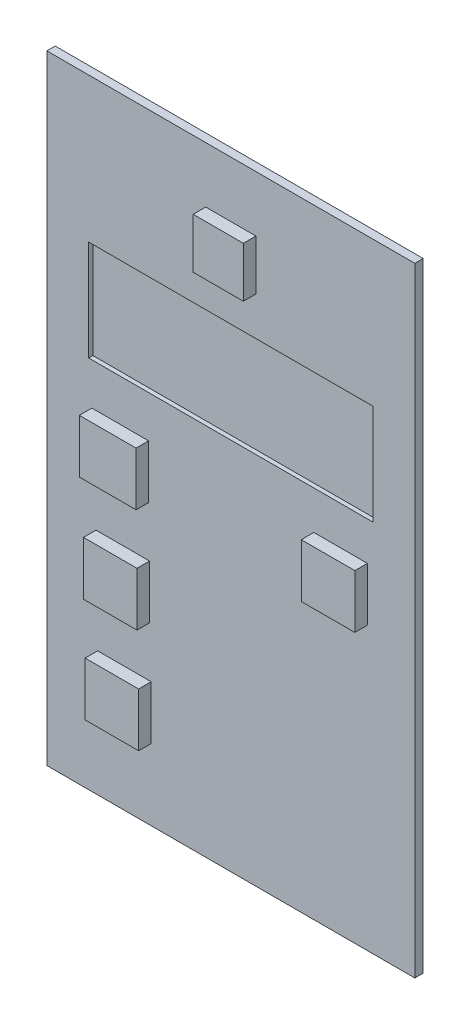
from build123d import *

# Parameters (mm, degrees)
SKETCH1_W           = 44
SKETCH1_H           = 74
BOSS_EXTRUDE1_DEPTH = 1
SKETCH2_W           = 34
SKETCH2_H           = 12
CUT_EXTRUDE1_DEPTH  = 0.5
SKETCH3_W           = 6
SKETCH3_H           = 6
BOSS_EXTRUDE2_DEPTH = 1.5
SKETCH5_W           = 6.780779409
SKETCH5_H           = 6.387690747
BOSS_EXTRUDE5_DEPTH = 1.5
SKETCH7_W           = 6.4
SKETCH7_H           = 6.4
BOSS_EXTRUDE6_DEPTH = 1.5
SKETCH8_W           = 6.4
SKETCH8_H           = 6.4
BOSS_EXTRUDE7_DEPTH = 1.5
SKETCH9_W           = 6.4
SKETCH9_H           = 6.4
BOSS_EXTRUDE8_DEPTH = 1.5


with BuildPart() as part:
    # Sketch1 → Boss-Extrude1 (new body)
    with BuildSketch(Plane.XY):
        with Locations((22, 37)):
            Rectangle(SKETCH1_W, SKETCH1_H)
    extrude(amount=BOSS_EXTRUDE1_DEPTH)

    # Sketch2 → Cut-Extrude1 (cut)
    with BuildSketch(Plane.XY.offset(1)):
        with Locations((22, 50.703569151)):
            Rectangle(SKETCH2_W, SKETCH2_H)
    extrude(amount=-CUT_EXTRUDE1_DEPTH, mode=Mode.SUBTRACT)

    # Sketch3 → Boss-Extrude2 (add)
    with BuildSketch(Plane.XY.offset(1)):
        with Locations((22, 64.322360922)):
            Rectangle(SKETCH3_W, SKETCH3_H)
    extrude(amount=BOSS_EXTRUDE2_DEPTH)

    # Sketch5 → Boss-Extrude5 (add)
    with BuildSketch(Plane.XY.offset(1)):
        with Locations((8.782393761, 36.508639174)):
            Rectangle(SKETCH5_W, SKETCH5_H)
    extrude(amount=BOSS_EXTRUDE5_DEPTH)

    # Sketch7 → Boss-Extrude6 (add)
    with BuildSketch(Plane.XY.offset(1)):
        with Locations((9.083364884, 24.1147938)):
            Rectangle(SKETCH7_W, SKETCH7_H)
    extrude(amount=BOSS_EXTRUDE6_DEPTH)

    # Sketch8 → Boss-Extrude7 (add)
    with BuildSketch(Plane.XY.offset(1)):
        with Locations((9.279909214, 11.7147938)):
            Rectangle(SKETCH8_W, SKETCH8_H)
    extrude(amount=BOSS_EXTRUDE7_DEPTH)

    # Sketch9 → Boss-Extrude8 (add)
    with BuildSketch(Plane.XY.offset(1)):
        with Locations((35.1254887, 36.895573208)):
            Rectangle(SKETCH9_W, SKETCH9_H)
    extrude(amount=BOSS_EXTRUDE8_DEPTH)


solid = part.part
